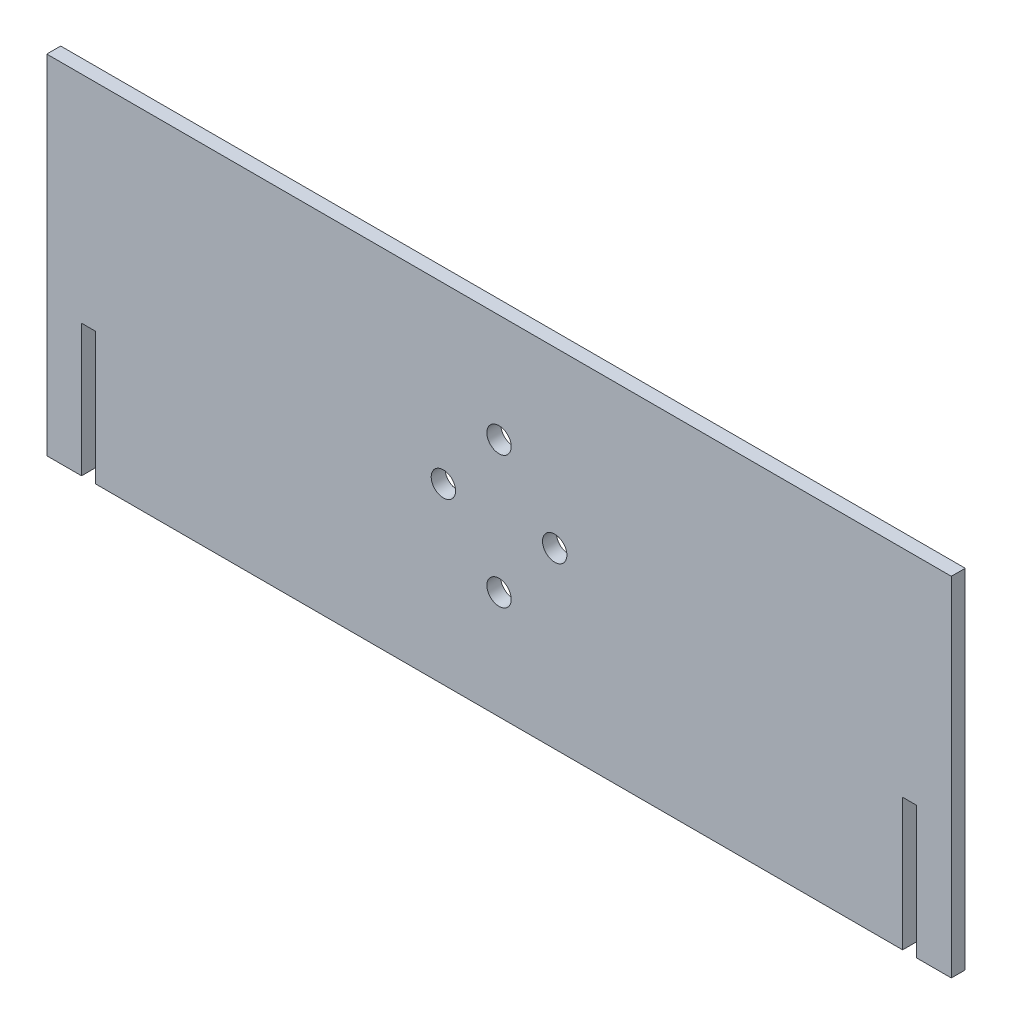
from build123d import *

# Parameters (mm, degrees)
SKETCH1_R           = 1.75
BOSS_EXTRUDE1_DEPTH = 1


with BuildPart() as part:
    # Sketch1 → Boss-Extrude1 (new, symmetric)
    with BuildSketch(Plane.XY):
        Polygon((-65, 25), (65, 25), (65, -25), (60, -25), (60, -6), (58, -6), (58, -25), (-58, -25), (-58, -6), (-60, -6), (-60, -25), (-65, -25), align=None)
        with Locations((0, 9.5)):
            Circle(SKETCH1_R, mode=Mode.SUBTRACT)
        with Locations((8, 0)):
            Circle(SKETCH1_R, mode=Mode.SUBTRACT)
        with Locations((0, -9.5)):
            Circle(SKETCH1_R, mode=Mode.SUBTRACT)
        with Locations((-8, 0)):
            Circle(SKETCH1_R, mode=Mode.SUBTRACT)
    extrude(amount=BOSS_EXTRUDE1_DEPTH, both=True)


solid = part.part
